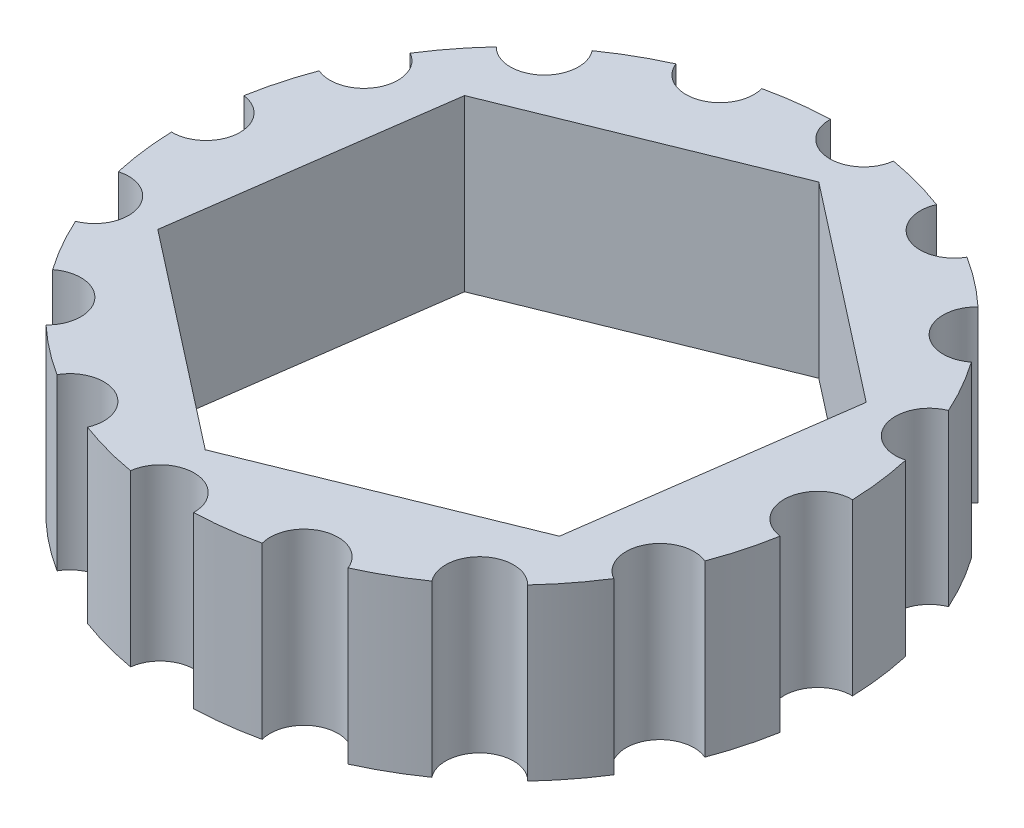
from build123d import *

# Parameters (mm, degrees)
SKETCH1_W             = 20
SKETCH1_H             = 20
SKETCH1_R             = 4
SKETCH1_H_2           = 10
BOSS_EXTRUDE2_DEPTH   = 2
SKETCH2_W             = 45
SKETCH2_H             = 60
SKETCH2_W_2           = 43
SKETCH2_H_2           = 58
BOSS_EXTRUDE3_DEPTH   = 4
SKETCH6_W             = 45
SKETCH6_H             = 30
BOSS_EXTRUDE4_DEPTH   = 2
CUT_EXTRUDE4_DEPTH    = 4
BOSS_EXTRUDE5_DEPTH   = 7
BOSS_EXTRUDE5_2_DEPTH = 7
BOSS_EXTRUDE5_3_DEPTH = 7
SKETCH14_R            = 4
CUT_EXTRUDE7_DEPTH    = 19
SKETCH20_R            = 9.7
BOSS_EXTRUDE6_DEPTH   = 5
CUT_EXTRUDE8_DEPTH    = 15
CUT_EXTRUDE9_DEPTH    = 15
CUT_EXTRUDE10_DEPTH   = 31
SKETCH24_W            = 45
SKETCH24_H            = 30
CUT_EXTRUDE11_DEPTH   = 31
SKETCH25_W            = 45
SKETCH25_H            = 60
CUT_EXTRUDE12_DEPTH   = 31
SKETCH26_R            = 1
CUT_EXTRUDE14_DEPTH   = 31
SKETCH28_R            = 8.330942509
BOSS_EXTRUDE7_DEPTH   = 5
CUT_EXTRUDE15_DEPTH   = 10


with BuildPart() as part:
    # Sketch1 → Boss-Extrude2 (new body)
    # profile 1 of 6: a face of its own
    with BuildSketch(Plane(origin=(0, 0, 0), x_dir=(1, 0, 0), z_dir=(0, 1, 0))):
        Polygon((-22.5, 10), (-10, 10), (10, 10), (22.5, 10), (22.5, 70), (-22.5, 70), align=None)
    # profile 2 of 6: a face of its own
    with BuildSketch(Plane(origin=(0, 0, 0), x_dir=(1, 0, 0), z_dir=(0, 1, 0))):
        Polygon((-22.5, 10), (-10, -10), (-10, 10), align=None)
    # profile 3 of 6: a face of its own
    with BuildSketch(Plane(origin=(0, 0, 0), x_dir=(1, 0, 0), z_dir=(0, 1, 0))):
        Polygon((10, 10), (10, -10), (22.5, 10), align=None)
    # profile 4 of 6: a face of its own
    with BuildSketch(Plane(origin=(0, 0, 0), x_dir=(1, 0, 0), z_dir=(0, 1, 0))):
        Rectangle(SKETCH1_W, SKETCH1_H)
        Circle(SKETCH1_R, mode=Mode.SUBTRACT)
    # profile 5 of 6: a face of its own
    with BuildSketch(Plane(origin=(0, 0, 0), x_dir=(1, 0, 0), z_dir=(0, 1, 0))):
        Circle(SKETCH1_R)
    # profile 6 of 6: a face of its own
    with BuildSketch(Plane(origin=(0, 0, 0), x_dir=(1, 0, 0), z_dir=(0, 1, 0))):
        with Locations((0, -15)):
            Rectangle(SKETCH1_W, SKETCH1_H_2)
    extrude(amount=BOSS_EXTRUDE2_DEPTH)

    # Sketch2 → Boss-Extrude3 (add)
    with BuildSketch(Plane(origin=(0, 2, 0), x_dir=(1, 0, 0), z_dir=(0, 1, 0))):
        with Locations((0, 40)):
            Rectangle(SKETCH2_W, SKETCH2_H)
        with Locations((0, 40)):
            Rectangle(SKETCH2_W_2, SKETCH2_H_2, mode=Mode.SUBTRACT)
    extrude(amount=BOSS_EXTRUDE3_DEPTH)

    # Sketch6 → Boss-Extrude4 (add)
    with BuildSketch(Plane(origin=(0, 2, 0), x_dir=(1, 0, 0), z_dir=(0, 1, 0))):
        with Locations((0, -5)):
            Rectangle(SKETCH6_W, SKETCH6_H)
    extrude(amount=-BOSS_EXTRUDE4_DEPTH)

    # Sketch7 → Cut-Extrude4 (cut)
    with BuildSketch(Plane(origin=(0, 2, 0), x_dir=(1, 0, 0), z_dir=(0, 1, 0))):
        with BuildLine():
            Line((9.5, 9.5), (-9.5, 9.5))
            Line((-9.5, 9.5), (-9.5, 2.122498999))
            ThreePointArc((-9.5, 2.122498999), (0, 9), (9.5, 2.122498999))
            Line((9.5, 2.122498999), (9.5, 9.5))
        make_face()
        with BuildLine():
            ThreePointArc((-5.267826876, -9.5), (-7.858215886, -7.184532568), (-9.5, -4.122498999))
            Line((-9.5, -4.122498999), (-9.5, -9.5))
            Line((-9.5, -9.5), (-5.267826876, -9.5))
        make_face()
        with BuildLine():
            Line((9.5, -9.5), (9.5, -4.122498999))
            ThreePointArc((9.5, -4.122498999), (7.858215886, -7.184532568), (5.267826876, -9.5))
            Line((5.267826876, -9.5), (9.5, -9.5))
        make_face()
    extrude(amount=-CUT_EXTRUDE4_DEPTH, mode=Mode.SUBTRACT)

    # Sketch14 → Cut-Extrude7 (cut)
    with BuildSketch(Plane.XZ):
        with Locations(Location((0, 1, 0), (0, 0, 270))):
            Circle(SKETCH14_R)
    extrude(amount=-CUT_EXTRUDE7_DEPTH, mode=Mode.SUBTRACT)

    # Sketch20 → Boss-Extrude6 (add)
    with BuildSketch(Plane(origin=(0, 2, 0), x_dir=(1, 0, 0), z_dir=(0, 1, 0))):
        with Locations(Location((0, -1, 0), (0, 0, 270))):
            Circle(SKETCH20_R)
        Polygon((7.160405698, -4.567714988), (7.585926887, 1.540415964), (3.567714988, 6.160405698), (-2.540415964, 6.585926887), (-7.160405698, 2.567714988), (-7.585926887, -3.540415964), (-3.567714988, -8.160405698), (2.540415964, -8.585926887), align=None, mode=Mode.SUBTRACT)
    extrude(amount=BOSS_EXTRUDE6_DEPTH)

    # Sketch24 → Cut-Extrude11 (cut)
    with BuildSketch(Plane(origin=(0, 2, 0), x_dir=(1, 0, 0), z_dir=(0, 1, 0))):
        with Locations((0, -5)):
            Rectangle(SKETCH24_W, SKETCH24_H)
    extrude(amount=-CUT_EXTRUDE11_DEPTH, mode=Mode.SUBTRACT)


with BuildPart() as body_2:
    # Sketch8 → Boss-Extrude5 (new body)
    with BuildSketch(Plane(origin=(0, 2, 0), x_dir=(1, 0, 0), z_dir=(0, 1, 0))):
        with BuildLine():
            Line((9.5, 2.122498999), (9.5, 9.5))
            Line((9.5, 9.5), (-9.5, 9.5))
            Line((-9.5, 9.5), (-9.5, 2.122498999))
            ThreePointArc((-9.5, 2.122498999), (0, 9), (9.5, 2.122498999))
        make_face()
    extrude(amount=BOSS_EXTRUDE5_DEPTH)

    # Sketch21 → Cut-Extrude8 (cut)
    with BuildSketch(Plane(origin=(0, 9, 0), x_dir=(1, 0, 0), z_dir=(0, 1, 0))):
        with BuildLine():
            Line((-9.5, 9.5), (-9.5, 2.122498999))
            ThreePointArc((-9.5, 2.122498999), (0, 9), (9.5, 2.122498999))
            Line((9.5, 2.122498999), (9.5, 9.5))
            Line((9.5, 9.5), (-9.5, 9.5))
        make_face()
    extrude(amount=-CUT_EXTRUDE8_DEPTH, mode=Mode.SUBTRACT)


with BuildPart() as body_3:
    # Sketch8 → Boss-Extrude5 2 (new body)
    with BuildSketch(Plane(origin=(0, 2, 0), x_dir=(1, 0, 0), z_dir=(0, 1, 0))):
        with BuildLine():
            Line((-9.5, -9.5), (-5.267826876, -9.5))
            ThreePointArc((-5.267826876, -9.5), (-7.858215886, -7.184532568), (-9.5, -4.122498999))
            Line((-9.5, -4.122498999), (-9.5, -9.5))
        make_face()
    extrude(amount=BOSS_EXTRUDE5_2_DEPTH)

    # Sketch22 → Cut-Extrude9 (cut)
    with BuildSketch(Plane(origin=(0, 9, 0), x_dir=(1, 0, 0), z_dir=(0, 1, 0))):
        with BuildLine():
            Line((-9.5, -4.122498999), (-9.5, -9.5))
            Line((-9.5, -9.5), (-5.267826876, -9.5))
            ThreePointArc((-5.267826876, -9.5), (-7.858215886, -7.184532568), (-9.5, -4.122498999))
        make_face()
    extrude(amount=-CUT_EXTRUDE9_DEPTH, mode=Mode.SUBTRACT)


with BuildPart() as body_4:
    # Sketch8 → Boss-Extrude5 3 (new body)
    with BuildSketch(Plane(origin=(0, 2, 0), x_dir=(1, 0, 0), z_dir=(0, 1, 0))):
        with BuildLine():
            Line((9.5, -9.5), (9.5, -4.122498999))
            ThreePointArc((9.5, -4.122498999), (7.858215886, -7.184532568), (5.267826876, -9.5))
            Line((5.267826876, -9.5), (9.5, -9.5))
        make_face()
    extrude(amount=BOSS_EXTRUDE5_3_DEPTH)

    # Sketch23 → Cut-Extrude10 (cut)
    with BuildSketch(Plane(origin=(0, 9, 0), x_dir=(1, 0, 0), z_dir=(0, 1, 0))):
        with BuildLine():
            Line((5.267826876, -9.5), (9.5, -9.5))
            Line((9.5, -9.5), (9.5, -4.122498999))
            ThreePointArc((9.5, -4.122498999), (7.858215886, -7.184532568), (5.267826876, -9.5))
        make_face()
    extrude(amount=-CUT_EXTRUDE10_DEPTH, mode=Mode.SUBTRACT)


with BuildPart() as cut_extrude11_piece_1:
    # of the separate pieces the step leaves, piece 1, a body of its own (cut_extrude11_pieces)
    add(part.part.solids().sort_by_distance((-22.5, 0, -10))[0])

    # Sketch25 → Cut-Extrude12 (cut)
    with BuildSketch(Plane(origin=(0, 6, 0), x_dir=(1, 0, 0), z_dir=(0, 1, 0))):
        with Locations((0, 40)):
            Rectangle(SKETCH25_W, SKETCH25_H)
    extrude(amount=-CUT_EXTRUDE12_DEPTH, mode=Mode.SUBTRACT)


with BuildPart() as cut_extrude11_piece_2:
    # of the separate pieces the step leaves, piece 2, a body of its own (cut_extrude11_pieces)
    add(part.part.solids().sort_by_distance((0, 2, 10.7))[0])

    # Sketch26 → Cut-Extrude14 (cut)
    with BuildSketch(Plane(origin=(0, 7, 0), x_dir=(1, 0, 0), z_dir=(0, 1, 0))):
        with Locations((0.674113898, 8.676547445)):
            Circle(SKETCH26_R)
        with Locations((-6.365681808, 6.319022826)):
            Circle(SKETCH26_R)
        with Locations((-9.676547445, -0.325886102)):
            Circle(SKETCH26_R)
        with Locations((-8.681991909, 3.325854423)):
            Circle(SKETCH26_R)
        with Locations((-9.19793635, -4.080254356)):
            Circle(SKETCH26_R)
        with Locations((-7.319022826, -7.365681808)):
            Circle(SKETCH26_R)
        with Locations((-4.325854423, -9.681991909)):
            Circle(SKETCH26_R)
        with Locations((-0.674113898, -10.676547445)):
            Circle(SKETCH26_R)
        with Locations((3.080254356, -10.19793635)):
            Circle(SKETCH26_R)
        with Locations((6.365681808, -8.319022826)):
            Circle(SKETCH26_R)
        with Locations((8.681991909, -5.325854423)):
            Circle(SKETCH26_R)
        with Locations((9.676547445, -1.674113898)):
            Circle(SKETCH26_R)
        with Locations((9.19793635, 2.080254356)):
            Circle(SKETCH26_R)
        with Locations((7.319022826, 5.365681808)):
            Circle(SKETCH26_R)
        with Locations((4.325854423, 7.681991909)):
            Circle(SKETCH26_R)
        with Locations((-3.080254356, 8.19793635)):
            Circle(SKETCH26_R)
    extrude(amount=-CUT_EXTRUDE14_DEPTH, mode=Mode.SUBTRACT)

    # Sketch28 → Boss-Extrude7 (add)
    with BuildSketch(Plane(origin=(0, 7, 0), x_dir=(1, 0, 0), z_dir=(0, 1, 0))):
        with Locations((0, -1)):
            Circle(SKETCH28_R)
    extrude(amount=-BOSS_EXTRUDE7_DEPTH)

    # Sketch29 → Cut-Extrude15 (cut)
    with BuildSketch(Plane(origin=(0, 7, 0), x_dir=(1, 0, 0), z_dir=(0, 1, 0))):
        Polygon((-6.311211771, 3.916157644), (-7.413123294, -4.0075909), (-1.101911524, -8.923748544), (6.311211771, -5.916157644), (7.413123294, 2.0075909), (1.101911524, 6.923748544), align=None)
    extrude(amount=-CUT_EXTRUDE15_DEPTH, mode=Mode.SUBTRACT)


solid = cut_extrude11_piece_2.part
